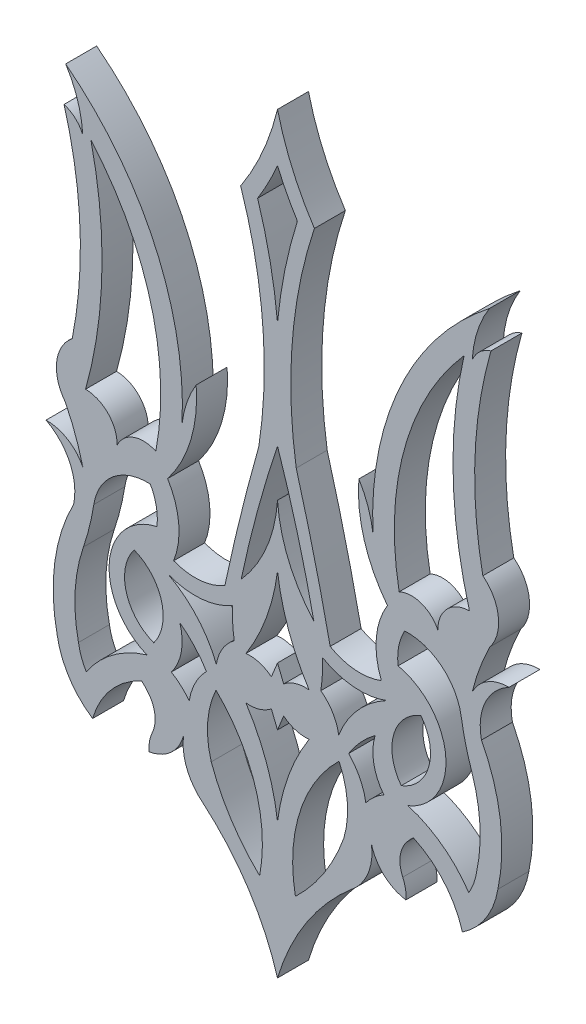
from build123d import *

# Parameters (mm, degrees)
EXTRUDE_1_DEPTH     = 10
CUT_EXTRUDE_4_DEPTH = 10
SCALE_1_SCALE       = 0.25


with BuildPart() as part:
    # Эскиз3 → Бобышка-Вытянуть1 (new body)
    with BuildSketch(Plane.XY):
        with BuildLine():
            ThreePointArc((75.737298173, 214.827117189), (82.873597213, 227.992034462), (87.644341315, 242.186463353))
            ThreePointArc((87.644341315, 242.186463353), (92.415085417, 227.992034462), (99.551384458, 214.827117189))
            ThreePointArc((99.551384458, 214.827117189), (92.448615199, 180.200274987), (93.683201055, 144.874033612))
            ThreePointArc((93.683201055, 144.874033612), (99.543941176, 122.77181273), (104.650975019, 100.483370703))
            ThreePointArc((104.650975019, 100.483370703), (112.761124808, 97.943619496), (121.169223706, 99.180041243))
            ThreePointArc((121.169223706, 99.180041243), (119.549894236, 110.406048742), (123.14170404, 121.164504703))
            ThreePointArc((123.14170404, 121.164504703), (115.644359384, 135.701433483), (113.915816321, 151.966261))
            ThreePointArc((113.915816321, 151.966261), (116.901405678, 145.64272451), (118.481996173, 138.830779763))
            ThreePointArc((118.481996173, 138.830779763), (127.24668609, 184.362661976), (156.055436754, 220.69485118))
            ThreePointArc((156.055436754, 220.69485118), (152.204137163, 212.503983736), (150.529344239, 203.609160148))
            ThreePointArc((150.529344239, 203.609160148), (152.949885488, 207.021489641), (156.580265974, 209.100756347))
            ThreePointArc((156.580265974, 209.100756347), (151.4198282, 177.15256964), (153.948768597, 144.889259016))
            ThreePointArc((153.948768597, 144.889259016), (158.962764238, 135.949313763), (156.186698644, 126.082387532))
            ThreePointArc((156.186698644, 126.082387532), (152.918092332, 118.533010155), (150.508133779, 110.667326092))
            ThreePointArc((150.508133779, 110.667326092), (155.402709379, 116.006658411), (162.390479703, 117.913594648))
            ThreePointArc((162.390479703, 117.913594648), (154.707516768, 109.824907217), (153.507722785, 98.733681937))
            ThreePointArc((153.507722785, 98.733681937), (159.570043449, 79.653195004), (158.80328853, 59.647475814))
            ThreePointArc((158.80328853, 59.647475814), (154.917566842, 49.613113406), (147.358546899, 41.95488388))
            ThreePointArc((147.358546899, 41.95488388), (141.45972495, 52.906488134), (131.532504975, 60.402089491))
            ThreePointArc((131.532504975, 60.402089491), (130.313453485, 59.224360677), (129.217982636, 57.930886552))
            ThreePointArc((129.217982636, 57.930886552), (127.222488275, 52.953447096), (128.085354098, 47.660776328))
            ThreePointArc((128.085354098, 47.660776328), (128.974997774, 44.792014096), (129.083146931, 41.790420124))
            ThreePointArc((129.083146931, 41.790420124), (122.02961795, 45.187826335), (117.983840441, 51.890536563))
            ThreePointArc((117.983840441, 51.890536563), (116.942345618, 43.244180813), (111.79351299, 36.220385415))
            ThreePointArc((111.79351299, 36.220385415), (97.034028223, 19.487966284), (87.644341315, -0.751846469))
            ThreePointArc((87.644341315, -0.751846469), (78.254654407, 19.487966284), (63.495169641, 36.220385415))
            ThreePointArc((63.495169641, 36.220385415), (58.346337012, 43.244180813), (57.30484219, 51.890536563))
            ThreePointArc((57.30484219, 51.890536563), (53.25906468, 45.187826335), (46.205535699, 41.790420124))
            ThreePointArc((46.205535699, 41.790420124), (46.313684857, 44.792014096), (47.203328533, 47.660776328))
            ThreePointArc((47.203328533, 47.660776328), (48.066194355, 52.953447096), (46.070699995, 57.930886552))
            ThreePointArc((46.070699995, 57.930886552), (44.975229145, 59.224360677), (43.756177656, 60.402089491))
            ThreePointArc((43.756177656, 60.402089491), (33.828957681, 52.906488134), (27.930135731, 41.95488388))
            ThreePointArc((27.930135731, 41.95488388), (20.371115788, 49.613113406), (16.4853941, 59.647475814))
            ThreePointArc((16.4853941, 59.647475814), (15.718639182, 79.653195004), (21.780959845, 98.733681937))
            ThreePointArc((21.780959845, 98.733681937), (20.581165862, 109.824907217), (12.898202928, 117.913594648))
            ThreePointArc((12.898202928, 117.913594648), (19.885973252, 116.006658411), (24.780548852, 110.667326092))
            ThreePointArc((24.780548852, 110.667326092), (22.370590299, 118.533010155), (19.101983986, 126.082387532))
            ThreePointArc((19.101983986, 126.082387532), (16.325918393, 135.949313763), (21.339914033, 144.889259016))
            ThreePointArc((21.339914033, 144.889259016), (23.868854431, 177.15256964), (18.708416657, 209.100756347))
            ThreePointArc((18.708416657, 209.100756347), (22.338797143, 207.021489641), (24.759338391, 203.609160148))
            ThreePointArc((24.759338391, 203.609160148), (23.084545467, 212.503983736), (19.233245877, 220.69485118))
            ThreePointArc((19.233245877, 220.69485118), (48.041996541, 184.362661976), (56.806686458, 138.830779763))
            ThreePointArc((56.806686458, 138.830779763), (58.387276952, 145.64272451), (61.37286631, 151.966261))
            ThreePointArc((61.37286631, 151.966261), (59.644323247, 135.701433483), (52.14697859, 121.164504703))
            ThreePointArc((52.14697859, 121.164504703), (55.738788395, 110.406048742), (54.119458925, 99.180041243))
            ThreePointArc((54.119458925, 99.180041243), (62.527557822, 97.943619496), (70.637707612, 100.483370703))
            ThreePointArc((70.637707612, 100.483370703), (75.744741455, 122.77181273), (81.605481576, 144.874033612))
            ThreePointArc((81.605481576, 144.874033612), (82.840067432, 180.200274987), (75.737298173, 214.827117189))
        make_face()
    extrude(amount=EXTRUDE_1_DEPTH)

    # Эскиз4 → Вырез-Вытянуть4 (cut)
    with BuildSketch(Plane.XY):
        with BuildLine():
            Line((85.654622356, 73.518555252), (87.644341315, 68.631836287))
            Line((87.644341315, 68.631836287), (89.634060275, 73.518555252))
            ThreePointArc((89.634060275, 73.518555252), (93.498316524, 71.48652915), (97.84617103, 71.089329421))
            ThreePointArc((97.84617103, 71.089329421), (91.177891627, 57.600515287), (87.644341315, 42.974234859))
            ThreePointArc((87.644341315, 42.974234859), (84.110791004, 57.600515287), (77.442511601, 71.089329421))
            ThreePointArc((77.442511601, 71.089329421), (81.790366107, 71.48652915), (85.654622356, 73.518555252))
        make_face()
        with BuildLine():
            Line((87.644341315, 87.368163713), (89.634060275, 82.481444748))
            ThreePointArc((89.634060275, 82.481444748), (93.498316524, 84.51347085), (97.84617103, 84.910670579))
            ThreePointArc((97.84617103, 84.910670579), (91.177891627, 98.399484713), (87.644341315, 113.025765141))
            ThreePointArc((87.644341315, 113.025765141), (84.110791004, 98.399484713), (77.442511601, 84.910670579))
            ThreePointArc((77.442511601, 84.910670579), (81.790366107, 84.51347085), (85.654622356, 82.481444748))
            Line((85.654622356, 82.481444748), (87.644341315, 87.368163713))
        make_face()
        with BuildLine():
            ThreePointArc((87.644341315, 148.003447902), (81.149794041, 126.61690118), (75.910198282, 104.888805053))
            ThreePointArc((75.910198282, 104.888805053), (84.118417763, 117.892428675), (87.644341315, 132.860292833))
            ThreePointArc((87.644341315, 132.860292833), (91.170264867, 117.892428675), (99.378484349, 104.888805053))
            ThreePointArc((99.378484349, 104.888805053), (94.138888589, 126.61690118), (87.644341315, 148.003447902))
        make_face()
        with BuildLine():
            ThreePointArc((67.78082661, 69.825446008), (80.476833117, 49.16569034), (81.871403931, 24.956823002))
            ThreePointArc((81.871403931, 24.956823002), (72.654345055, 36.068206288), (66.24306766, 49.003140961))
            ThreePointArc((66.24306766, 49.003140961), (65.085086418, 59.556595084), (67.78082661, 69.825446008))
        make_face()
        with BuildLine():
            ThreePointArc((64.682165911, 73.518555252), (60.834261147, 78.585776038), (56.108384596, 82.845962464))
            ThreePointArc((56.108384596, 82.845962464), (56.577504562, 74.908677344), (53.334779442, 67.648835581))
            ThreePointArc((53.334779442, 67.648835581), (56.48094396, 65.35561463), (59.118823877, 62.492259422))
            ThreePointArc((59.118823877, 62.492259422), (61.041725308, 68.438701437), (64.682165911, 73.518555252))
        make_face()
        with BuildLine():
            ThreePointArc((67.908044121, 77.068549767), (61.672372831, 87.192623316), (52.307890576, 94.519760123))
            ThreePointArc((52.307890576, 94.519760123), (62.92084749, 92.959111172), (73.157724023, 96.164862015))
            ThreePointArc((73.157724023, 96.164862015), (73.141858231, 91.35681801), (73.672035417, 86.578068066))
            ThreePointArc((73.672035417, 86.578068066), (69.829998601, 82.405217354), (67.908044121, 77.068549767))
        make_face()
        with BuildLine():
            ThreePointArc((41.355166098, 95.816406993), (50.176134503, 85.986630032), (47.690712162, 73.01525098))
            ThreePointArc((47.690712162, 73.01525098), (38.779973269, 82.820084247), (41.355166098, 95.816406993))
        make_face()
        with BuildLine():
            ThreePointArc((133.933516533, 95.816406993), (136.508709361, 82.820084247), (127.597970468, 73.01525098))
            ThreePointArc((127.597970468, 73.01525098), (125.112548128, 85.986630032), (133.933516533, 95.816406993))
        make_face()
        with BuildLine():
            ThreePointArc((101.616647213, 86.578068066), (102.1468244, 91.35681801), (102.130958608, 96.164862015))
            ThreePointArc((102.130958608, 96.164862015), (112.36783514, 92.959111172), (122.980792054, 94.519760123))
            ThreePointArc((122.980792054, 94.519760123), (113.6163098, 87.192623316), (107.38063851, 77.068549767))
            ThreePointArc((107.38063851, 77.068549767), (105.45868403, 82.405217354), (101.616647213, 86.578068066))
        make_face()
        with BuildLine():
            ThreePointArc((116.169858754, 62.492259422), (118.807738671, 65.35561463), (121.953903189, 67.648835581))
            ThreePointArc((121.953903189, 67.648835581), (118.711178069, 74.908677344), (119.180298034, 82.845962464))
            ThreePointArc((119.180298034, 82.845962464), (114.454421483, 78.585776038), (110.60651672, 73.518555252))
            ThreePointArc((110.60651672, 73.518555252), (114.246957322, 68.438701437), (116.169858754, 62.492259422))
        make_face()
        with BuildLine():
            ThreePointArc((109.045614971, 49.003140961), (110.203596213, 59.556595084), (107.507856021, 69.825446008))
            ThreePointArc((107.507856021, 69.825446008), (94.811849514, 49.16569034), (93.417278699, 24.956823002))
            ThreePointArc((93.417278699, 24.956823002), (102.634337575, 36.068206288), (109.045614971, 49.003140961))
        make_face()
        with BuildLine():
            ThreePointArc((46.570080759, 116.846320473), (34.595716893, 112.920248845), (28.316429178, 101.994592151))
            ThreePointArc((28.316429178, 101.994592151), (26.9333239, 95.142193412), (24.957292002, 88.436699647))
            ThreePointArc((24.957292002, 88.436699647), (22.277621632, 74.801992121), (23.365701976, 60.94912369))
            ThreePointArc((23.365701976, 60.94912369), (24.292977573, 57.352257012), (25.886565586, 53.996997383))
            ThreePointArc((25.886565586, 53.996997383), (34.413462447, 62.958528928), (45.462301972, 68.520917162))
            ThreePointArc((45.462301972, 68.520917162), (33.315609183, 88.459157063), (48.700428736, 106.019990853))
            ThreePointArc((48.700428736, 106.019990853), (48.506236595, 111.604542872), (46.570080759, 116.846320473))
        make_face()
        with BuildLine():
            ThreePointArc((151.922980655, 60.94912369), (150.995705058, 57.352257012), (149.402117045, 53.996997383))
            ThreePointArc((149.402117045, 53.996997383), (140.875220183, 62.958528928), (129.826380659, 68.520917162))
            ThreePointArc((129.826380659, 68.520917162), (141.973073448, 88.459157063), (126.588253895, 106.019990853))
            ThreePointArc((126.588253895, 106.019990853), (126.782446036, 111.604542872), (128.718601872, 116.846320473))
            ThreePointArc((128.718601872, 116.846320473), (140.692965737, 112.920248845), (146.972253453, 101.994592151))
            ThreePointArc((146.972253453, 101.994592151), (148.355358731, 95.142193412), (150.331390628, 88.436699647))
            ThreePointArc((150.331390628, 88.436699647), (153.011060999, 74.801992121), (151.922980655, 60.94912369))
        make_face()
        with BuildLine():
            ThreePointArc((48.355392718, 126.900367718), (46.714086351, 167.601052005), (27.386922462, 203.457715599))
            ThreePointArc((27.386922462, 203.457715599), (30.940238269, 168.082502681), (25.662297387, 132.923221086))
            ThreePointArc((25.662297387, 132.923221086), (32.940011964, 129.766489423), (35.853986928, 122.388221729))
            ThreePointArc((35.853986928, 122.388221729), (41.170193791, 127.233420637), (48.355392718, 126.900367718))
        make_face()
        with BuildLine():
            ThreePointArc((139.434695702, 122.388221729), (134.11848884, 127.233420637), (126.933289913, 126.900367718))
            ThreePointArc((126.933289913, 126.900367718), (128.57459628, 167.601052005), (147.901760168, 203.457715599))
            ThreePointArc((147.901760168, 203.457715599), (144.348444361, 168.082502681), (149.626385244, 132.923221086))
            ThreePointArc((149.626385244, 132.923221086), (142.348670666, 129.766489423), (139.434695702, 122.388221729))
        make_face()
        with BuildLine():
            ThreePointArc((94.066919651, 214.119894368), (90.031739471, 198.523177696), (87.644341315, 182.590802479))
            ThreePointArc((87.644341315, 182.590802479), (85.25694316, 198.523177696), (81.22176298, 214.119894368))
            ThreePointArc((81.22176298, 214.119894368), (84.665732339, 220.152220055), (87.644341315, 226.427390706))
            ThreePointArc((87.644341315, 226.427390706), (90.622950292, 220.152220055), (94.066919651, 214.119894368))
        make_face()
    extrude(amount=CUT_EXTRUDE_4_DEPTH, mode=Mode.SUBTRACT)


with BuildPart() as part_1:
    # Масштаб1: scaled about (87.644341315, 110.400596094, 5)
    add(part.part.scale(SCALE_1_SCALE).moved(Location((65.733255986, 82.80044707, 3.75))))


solid = part_1.part
